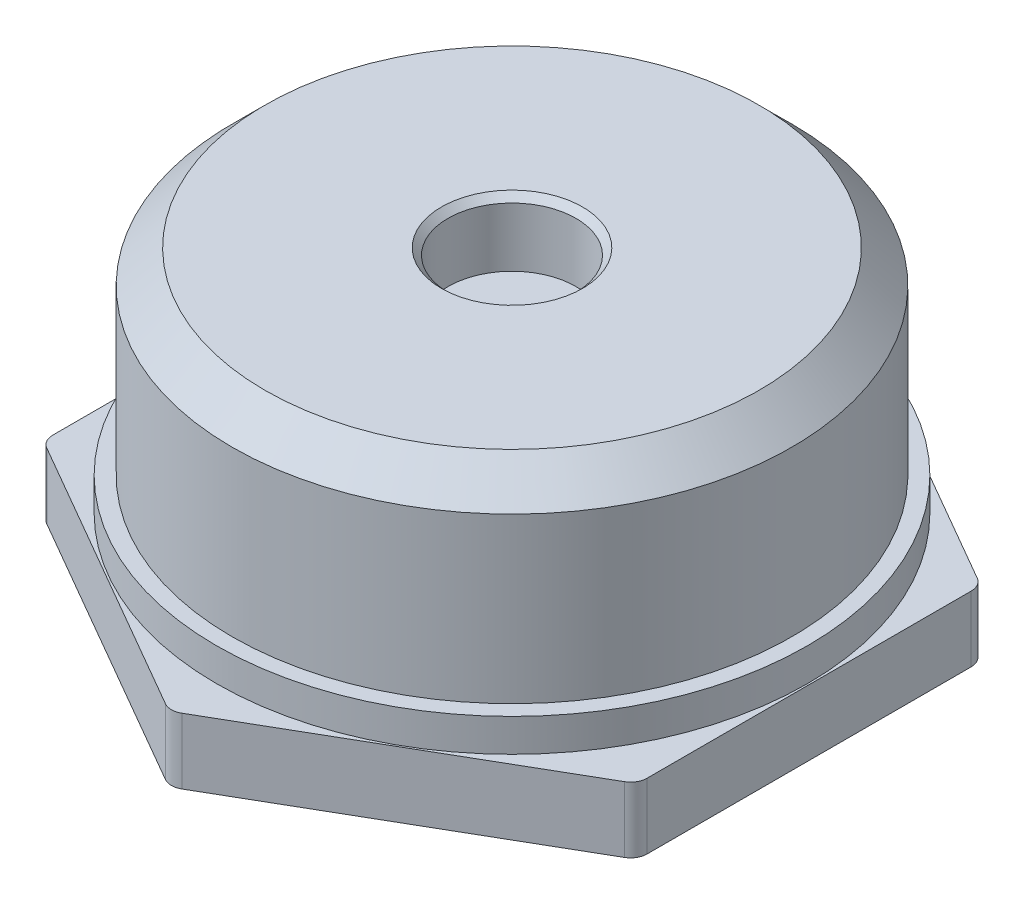
from build123d import *

# Parameters (mm, degrees)
BOSS_EXTRUDE1_DEPTH      = 2
FILLET1_R                = 0.5
SKETCH2_R                = 9
BOSS_EXTRUDE2_DEPTH      = 1
SKETCH3_R                = 8.525
BOSS_EXTRUDE3_DEPTH      = 4
CUT_EXTRUDE1_DEPTH       = 16.443289468
BOSS_EXTRUDE4_DEPTH      = 1
BOSS_EXTRUDE4_DEPTH_BACK = 1
SKETCH5_R                = 8.525
SKETCH6_R                = 8.525
BOSS_EXTRUDE5_DEPTH      = 1
CHAMFER2_SIZE            = 1
SKETCH7_R                = 1.95
CUT_EXTRUDE2_DEPTH       = 2
CHAMFER3_SIZE            = 0.2


with BuildPart() as part:
    # Sketch1 → Boss-Extrude1 (new body)
    with BuildSketch(Plane(origin=(0, 31, 0), x_dir=(1, 0, 0), z_dir=(0, 1, 0))):
        Polygon((0, 10.450039872), (-9.05, 5.225019936), (-9.05, -5.225019936), (0, -10.450039872), (9.05, -5.225019936), (9.05, 5.225019936), align=None)
    extrude(amount=BOSS_EXTRUDE1_DEPTH)

    # Fillet1
    fillet1_edges = [part.edges().sort_by_distance(p)[0] for p in [
        (9.05, 32, -5.225019936),
        (9.05, 32, 5.225019936),
        (0, 32, 10.450039872),
        (-9.05, 32, 5.225019936),
        (-9.05, 32, -5.225019936),
        (0, 32, -10.450039872),
    ]]
    fillet(fillet1_edges, radius=FILLET1_R)

    # Sketch2 → Boss-Extrude2 (add)
    with BuildSketch(Plane(origin=(0, 33, 0), x_dir=(1, 0, 0), z_dir=(0, 1, 0))):
        with Locations(Location((0, 0, 0), (0, 0, 270))):
            Circle(SKETCH2_R)
    extrude(amount=BOSS_EXTRUDE2_DEPTH)

    # Sketch3 → Boss-Extrude3 (add)
    with BuildSketch(Plane(origin=(0, 34, 0), x_dir=(1, 0, 0), z_dir=(0, 1, 0))):
        with Locations(Location((0, 0, 0), (0, 0, 270))):
            Circle(SKETCH3_R)
    extrude(amount=BOSS_EXTRUDE3_DEPTH)

    # Sketch4 → Cut-Extrude1 (cut, through all)
    with BuildSketch(Plane(origin=(0, 38, 0), x_dir=(1, 0, 0), z_dir=(0, 1, 0))):
        Polygon((0, 2.886751346), (-2.5, 1.443375673), (-2.5, -1.443375673), (0, -2.886751346), (2.5, -1.443375673), (2.5, 1.443375673), align=None)
    extrude(amount=-CUT_EXTRUDE1_DEPTH, mode=Mode.SUBTRACT)

    # Sketch5 → Boss-Extrude4 (add, two sides: drawn at the far end of the back side and taken through both)
    with BuildSketch(Plane(origin=(0, 38, 0), x_dir=(1, 0, 0), z_dir=(0, 1, 0)).offset(-BOSS_EXTRUDE4_DEPTH_BACK)):
        with Locations(Location((0, 0, 0), (0, 0, 270))):
            Circle(SKETCH5_R)
    extrude(amount=BOSS_EXTRUDE4_DEPTH + BOSS_EXTRUDE4_DEPTH_BACK)

    # Sketch6 → Boss-Extrude5 (add)
    with BuildSketch(Plane(origin=(0, 39, 0), x_dir=(1, 0, 0), z_dir=(0, 1, 0))):
        with Locations(Location((0, 0, 0), (0, 0, 270))):
            Circle(SKETCH6_R)
    extrude(amount=BOSS_EXTRUDE5_DEPTH)

    # Chamfer2
    chamfer2_edges = [part.edges().sort_by_distance(p)[0] for p in [
        (0, 40, -8.525),
    ]]
    chamfer(chamfer2_edges, length=CHAMFER2_SIZE)

    # Sketch7 → Cut-Extrude2 (cut)
    with BuildSketch(Plane(origin=(0, 40, 0), x_dir=(1, 0, 0), z_dir=(0, 1, 0))):
        with Locations(Location((0, 0, 0), (0, 0, 270))):
            Circle(SKETCH7_R)
    extrude(amount=-CUT_EXTRUDE2_DEPTH, mode=Mode.SUBTRACT)

    # Chamfer3
    chamfer3_edges = [part.edges().sort_by_distance(p)[0] for p in [
        (0, 40, -1.95),
    ]]
    chamfer(chamfer3_edges, length=CHAMFER3_SIZE)


solid = part.part
